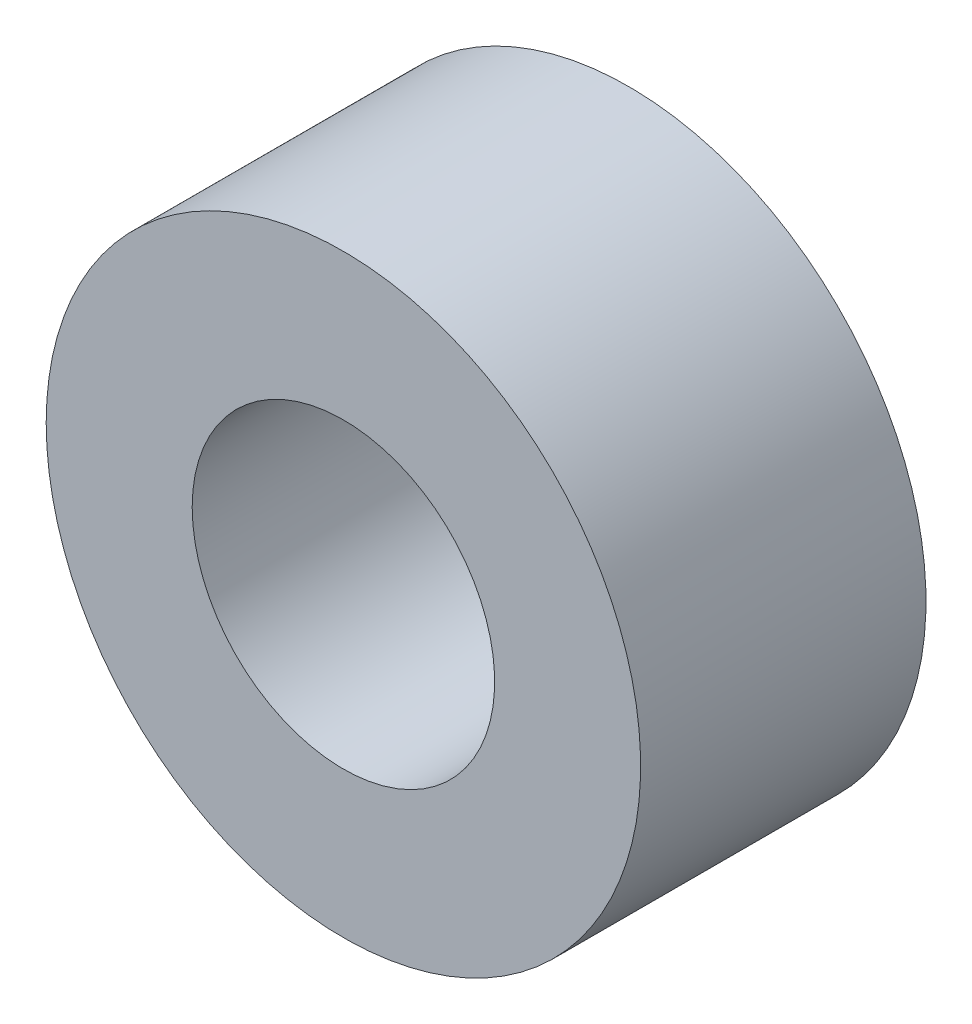
from build123d import *

# Parameters (mm, degrees)
SKETCH1_R           = 7.9375
SKETCH1_R_2         = 4.0386
BOSS_EXTRUDE1_DEPTH = 7.62


with BuildPart() as part:
    # Sketch1 → Boss-Extrude1 (new body)
    with BuildSketch(Plane.XY):
        with Locations(Location((0, 0, 0), (0, 0, 180))):
            Circle(SKETCH1_R)
        with Locations(Location((0, 0, 0), (0, 0, 180))):
            Circle(SKETCH1_R_2, mode=Mode.SUBTRACT)
    extrude(amount=BOSS_EXTRUDE1_DEPTH)


solid = part.part
